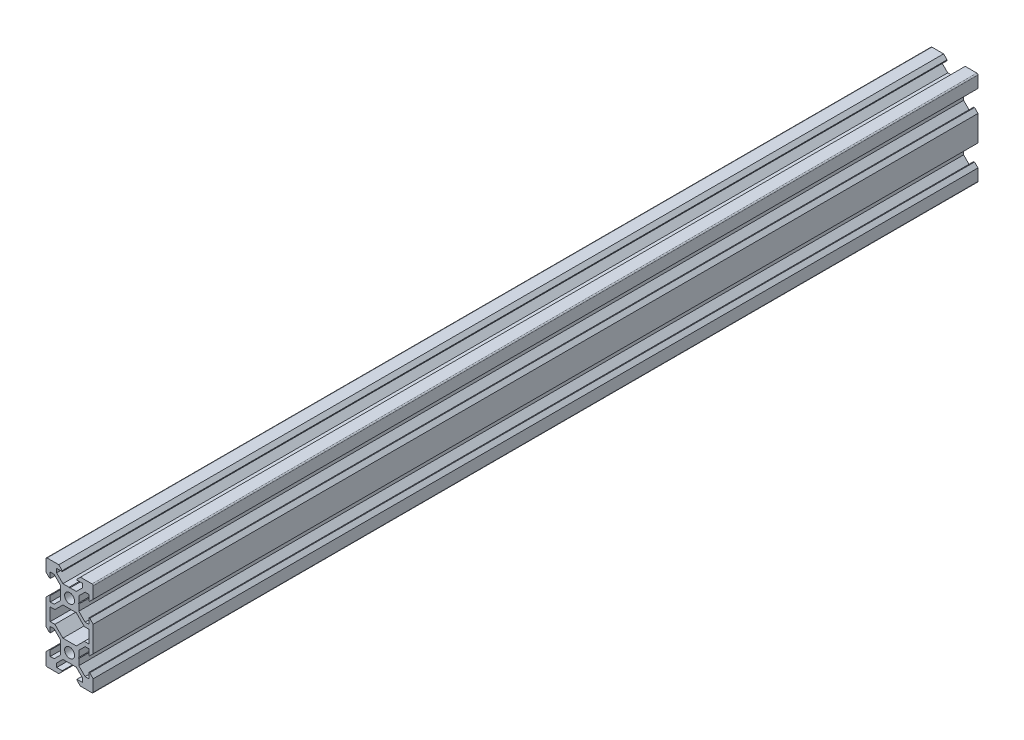
from build123d import *

# Parameters (mm, degrees)
SKETCH1_R           = 2.1
BOSS_EXTRUDE1_DEPTH = 375


with BuildPart() as part:
    # Sketch1 → Boss-Extrude1 (new body)
    with BuildSketch(Plane.XY):
        with BuildLine():
            Line((4.58, -20), (9.5, -20))
            ThreePointArc((9.5, -20), (9.853553391, -19.853553391), (10, -19.5))
            Line((10, -19.5), (10, -14.58))
            Line((10, -14.58), (8.545, -13.125))
            Line((8.545, -13.125), (8.2, -13.125))
            Line((8.2, -13.125), (8.2, -15.5))
            Line((8.2, -15.5), (6.560660172, -15.5))
            Line((6.560660172, -15.5), (3.9, -12.839339828))
            Line((3.9, -12.839339828), (3.9, -10.21))
            Line((3.9, -10.21), (3.69, -10))
            Line((3.69, -10), (3.9, -9.79))
            Line((3.9, -9.79), (3.9, -7.160660172))
            Line((3.9, -7.160660172), (6.560660172, -4.5))
            Line((6.560660172, -4.5), (8.2, -4.5))
            Line((8.2, -4.5), (8.2, -6.875))
            Line((8.2, -6.875), (8.545, -6.875))
            Line((8.545, -6.875), (10, -5.42))
            Line((10, -5.42), (10, 5.42))
            Line((10, 5.42), (8.545, 6.875))
            Line((8.545, 6.875), (8.2, 6.875))
            Line((8.2, 6.875), (8.2, 4.5))
            Line((8.2, 4.5), (6.560660172, 4.5))
            Line((6.560660172, 4.5), (3.9, 7.160660172))
            Line((3.9, 7.160660172), (3.9, 9.79))
            Line((3.9, 9.79), (3.69, 10))
            Line((3.69, 10), (3.9, 10.21))
            Line((3.9, 10.21), (3.9, 12.839339828))
            Line((3.9, 12.839339828), (6.560660172, 15.5))
            Line((6.560660172, 15.5), (8.2, 15.5))
            Line((8.2, 15.5), (8.2, 13.125))
            Line((8.2, 13.125), (8.545, 13.125))
            Line((8.545, 13.125), (10, 14.58))
            Line((10, 14.58), (10, 19.5))
            ThreePointArc((10, 19.5), (9.853553391, 19.853553391), (9.5, 20))
            Line((9.5, 20), (4.58, 20))
            Line((4.58, 20), (3.125, 18.545))
            Line((3.125, 18.545), (3.125, 18.2))
            Line((3.125, 18.2), (5.5, 18.2))
            Line((5.5, 18.2), (5.5, 16.560660172))
            Line((5.5, 16.560660172), (2.839339828, 13.9))
            Line((2.839339828, 13.9), (0.21, 13.9))
            Line((0.21, 13.9), (0, 13.69))
            Line((0, 13.69), (-0.21, 13.9))
            Line((-0.21, 13.9), (-2.839339828, 13.9))
            Line((-2.839339828, 13.9), (-5.5, 16.560660172))
            Line((-5.5, 16.560660172), (-5.5, 18.2))
            Line((-5.5, 18.2), (-3.125, 18.2))
            Line((-3.125, 18.2), (-3.125, 18.545))
            Line((-3.125, 18.545), (-4.58, 20))
            Line((-4.58, 20), (-9.5, 20))
            ThreePointArc((-9.5, 20), (-9.853553391, 19.853553391), (-10, 19.5))
            Line((-10, 19.5), (-10, 14.58))
            Line((-10, 14.58), (-8.545, 13.125))
            Line((-8.545, 13.125), (-8.2, 13.125))
            Line((-8.2, 13.125), (-8.2, 15.5))
            Line((-8.2, 15.5), (-6.560660172, 15.5))
            Line((-6.560660172, 15.5), (-3.9, 12.839339828))
            Line((-3.9, 12.839339828), (-3.9, 10.21))
            Line((-3.9, 10.21), (-3.69, 10))
            Line((-3.69, 10), (-3.9, 9.79))
            Line((-3.9, 9.79), (-3.9, 7.160660172))
            Line((-3.9, 7.160660172), (-6.560660172, 4.5))
            Line((-6.560660172, 4.5), (-8.2, 4.5))
            Line((-8.2, 4.5), (-8.2, 6.875))
            Line((-8.2, 6.875), (-8.545, 6.875))
            Line((-8.545, 6.875), (-10, 5.42))
            Line((-10, 5.42), (-10, -5.42))
            Line((-10, -5.42), (-8.545, -6.875))
            Line((-8.545, -6.875), (-8.2, -6.875))
            Line((-8.2, -6.875), (-8.2, -4.5))
            Line((-8.2, -4.5), (-6.560660172, -4.5))
            Line((-6.560660172, -4.5), (-3.9, -7.160660172))
            Line((-3.9, -7.160660172), (-3.9, -9.79))
            Line((-3.9, -9.79), (-3.69, -10))
            Line((-3.69, -10), (-3.9, -10.21))
            Line((-3.9, -10.21), (-3.9, -12.839339828))
            Line((-3.9, -12.839339828), (-6.560660172, -15.5))
            Line((-6.560660172, -15.5), (-8.2, -15.5))
            Line((-8.2, -15.5), (-8.2, -13.125))
            Line((-8.2, -13.125), (-8.545, -13.125))
            Line((-8.545, -13.125), (-10, -14.58))
            Line((-10, -14.58), (-10, -19.5))
            ThreePointArc((-10, -19.5), (-9.853553391, -19.853553391), (-9.5, -20))
            Line((-9.5, -20), (-4.58, -20))
            Line((-4.58, -20), (-3.125, -18.545))
            Line((-3.125, -18.545), (-3.125, -18.2))
            Line((-3.125, -18.2), (-5.5, -18.2))
            Line((-5.5, -18.2), (-5.5, -16.560660172))
            Line((-5.5, -16.560660172), (-2.839339828, -13.9))
            Line((-2.839339828, -13.9), (-0.21, -13.9))
            Line((-0.21, -13.9), (0, -13.69))
            Line((0, -13.69), (0.21, -13.9))
            Line((0.21, -13.9), (2.839339828, -13.9))
            Line((2.839339828, -13.9), (5.5, -16.560660172))
            Line((5.5, -16.560660172), (5.5, -18.2))
            Line((5.5, -18.2), (3.125, -18.2))
            Line((3.125, -18.2), (3.125, -18.545))
            Line((3.125, -18.545), (4.58, -20))
        make_face()
        with Locations((0, -10)):
            Circle(SKETCH1_R, mode=Mode.SUBTRACT)
        Polygon((-6.239339828, -2.7), (-8.2, -2.7), (-8.2, 2.7), (-6.239339828, 2.7), (-2.839339828, 6.1), (2.839339828, 6.1), (6.239339828, 2.7), (8.2, 2.7), (8.2, -2.7), (6.239339828, -2.7), (2.839339828, -6.1), (-2.839339828, -6.1), align=None, mode=Mode.SUBTRACT)
        with Locations((0, 10)):
            Circle(SKETCH1_R, mode=Mode.SUBTRACT)
    extrude(amount=BOSS_EXTRUDE1_DEPTH)


solid = part.part
